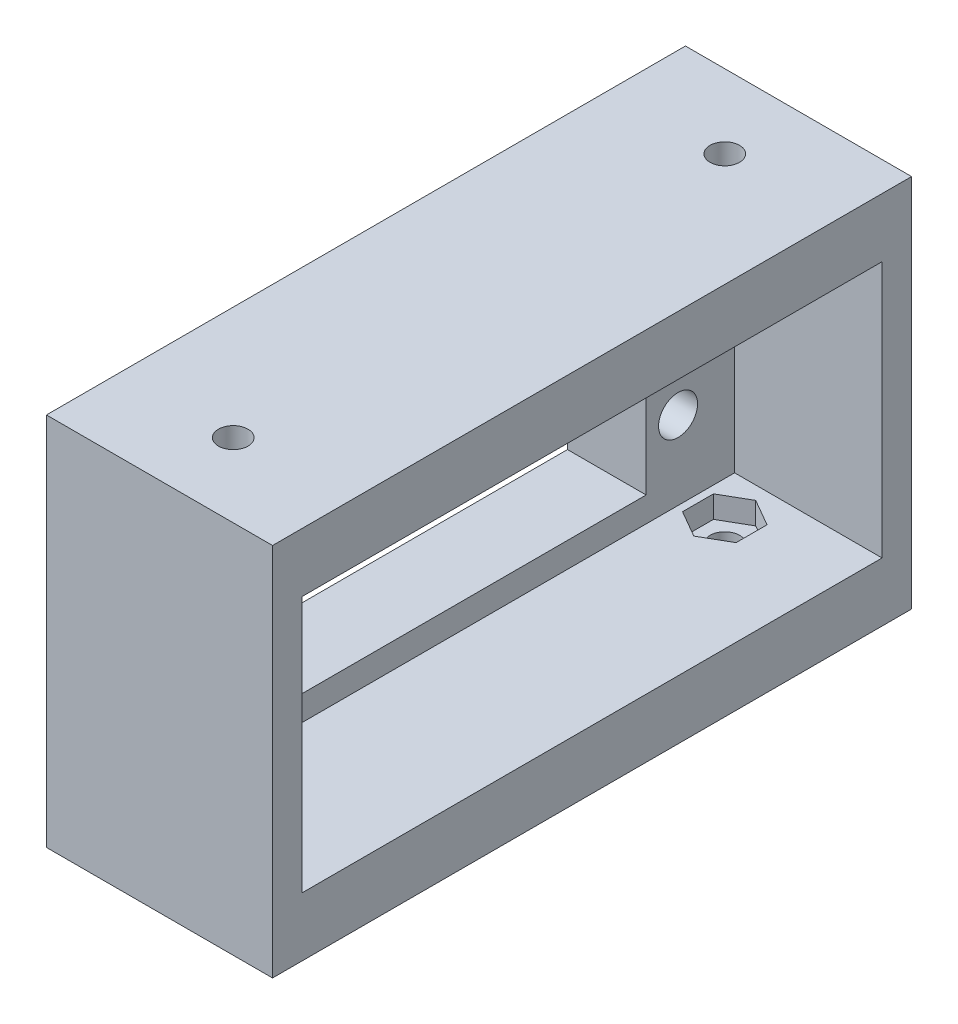
from build123d import *

# Parameters (mm, degrees)
SKETCH1_W                                = 65
SKETCH1_H                                = 38.1
SKETCH1_W_2                              = 41
SKETCH1_H_2                              = 21
BOSS_EXTRUDE1_DEPTH                      = 8
SKETCH2_W                                = 65
SKETCH2_H                                = 38.1
SKETCH2_W_2                              = 59
SKETCH2_H_2                              = 26.1
BOSS_EXTRUDE2_DEPTH                      = 15
F_5_32_0_15625_DIAMETER_HOLE1_D          = 3.96875
F_3_0MM_DOWEL_HOLE1_D                    = 3
F_3_0MM_DOWEL_HOLE1_DEPTH                = 6
CUT_EXTRUDE1_DEPTH                       = 2.25
MIRROR2_AT_THE_SECOND_PLANE_COPY_1_DEPTH = 2.25
SKETCH9_W                                = 6
SKETCH9_H                                = 2
CUT_EXTRUDE2_DEPTH                       = 8


with BuildPart() as part:
    # Sketch1 → Boss-Extrude1 (new body)
    with BuildSketch(Plane(origin=(0, 0, 0), x_dir=(0, 0, -1), z_dir=(1, 0, 0))):
        Rectangle(SKETCH1_W, SKETCH1_H)
        Rectangle(SKETCH1_W_2, SKETCH1_H_2, mode=Mode.SUBTRACT)
    extrude(amount=BOSS_EXTRUDE1_DEPTH)

    # Sketch2 → Boss-Extrude2 (add)
    with BuildSketch(Plane(origin=(8, 0, 0), x_dir=(0, 0, -1), z_dir=(1, 0, 0))):
        Rectangle(SKETCH2_W, SKETCH2_H)
        Rectangle(SKETCH2_W_2, SKETCH2_H_2, mode=Mode.SUBTRACT)
    extrude(amount=BOSS_EXTRUDE2_DEPTH)

    # 5/32 (0.15625) Diameter Hole1 (through all)
    with Locations(Plane.ZY):
        with Locations((-23.60854322, 5.122882485), (-23.749, -5.08), (23.749, -5.08), (23.749, 5.08)):
            Hole(F_5_32_0_15625_DIAMETER_HOLE1_D / 2)

    # Ø3.0mm Dowel Hole1
    with Locations(Plane(origin=(0, -13.05, 0), x_dir=(1, 0, 0), z_dir=(0, 1, 0))):
        with Locations((11.5, 25), (11.5, -25)):
            f_3_0mm_dowel_hole1 = Hole(F_3_0MM_DOWEL_HOLE1_D / 2, depth=F_3_0MM_DOWEL_HOLE1_DEPTH)

    # Mirror1: Ø3.0mm Dowel Hole1 across plane
    add(f_3_0mm_dowel_hole1.mirror(Plane.ZX), mode=Mode.SUBTRACT)

    # Sketch7 → Cut-Extrude1 (cut)
    with BuildSketch(Plane(origin=(0, -13.05, 0), x_dir=(1, 0, 0), z_dir=(0, 1, 0))):
        Polygon((8.775, -26.573279484), (11.5, -28.146558967), (14.225, -26.573279484), (14.225, -23.426720516), (11.5, -21.853441033), (8.775, -23.426720516), align=None)
    cut_extrude1 = extrude(amount=-CUT_EXTRUDE1_DEPTH, mode=Mode.SUBTRACT)

    # Mirror2: Cut-Extrude1 across plane
    add(cut_extrude1.mirror(Plane.ZX), mode=Mode.SUBTRACT)

    # Mirror2 at the second plane: Cut-Extrude1 across plane
    add(cut_extrude1.mirror(Plane.XY), mode=Mode.SUBTRACT)

    # Mirror2 at the second plane copy 1 sketc → Mirror2 at the second plane copy 1 (cut)
    with BuildSketch(Plane.XZ.offset(-13.05)):
        Polygon((8.775, -26.573279484), (11.5, -28.146558967), (14.225, -26.573279484), (14.225, -23.426720516), (11.5, -21.853441033), (8.775, -23.426720516), align=None)
    extrude(amount=-MIRROR2_AT_THE_SECOND_PLANE_COPY_1_DEPTH, mode=Mode.SUBTRACT)

    # Sketch9 → Cut-Extrude2 (cut)
    with BuildSketch(Plane.ZY):
        with Locations((-23.5, 0)):
            Rectangle(SKETCH9_W, SKETCH9_H)
        with Locations((23.5, 0)):
            Rectangle(SKETCH9_W, SKETCH9_H)
    extrude(amount=-CUT_EXTRUDE2_DEPTH, mode=Mode.SUBTRACT)


solid = part.part
